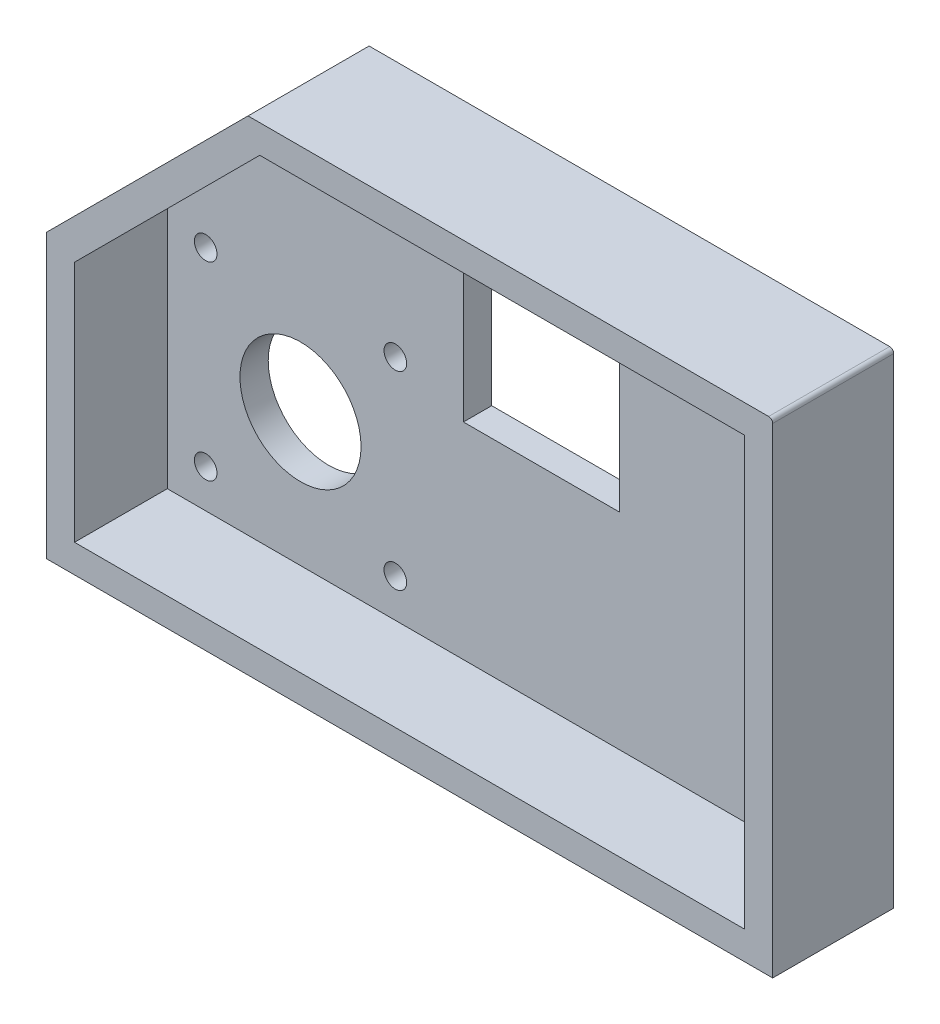
from build123d import *

# Parameters (mm, degrees)
BOSS_EXTRUDE1_DEPTH  = 30
SHELL1_T             = -7
SKETCH2_R            = 15
CUT_EXTRUDE1_DEPTH   = 20
SKETCH3_R            = 2.805999004
CUT_EXTRUDE2_DEPTH   = 20
LPATTERN1_COUNT      = 2
LPATTERN1_PITCH      = 47
LPATTERN1_COUNT_DIR2 = 2
LPATTERN1_PITCH_DIR2 = 47
SKETCH4_W            = 38.622861656
SKETCH4_H            = 38.365375911
CUT_EXTRUDE3_DEPTH   = 20


with BuildPart() as part:
    # Sketch1 → Boss-Extrude1 (new body)
    with BuildSketch(Plane.XY):
        with BuildLine():
            Line((-48.579903717, 70.777906396), (-98.579903717, 20.777906396))
            Line((-98.579903717, 20.777906396), (-98.579903717, -49.222093604))
            Line((-98.579903717, -49.222093604), (81.420096283, -49.222093604))
            Line((81.420096283, -49.222093604), (81.420096283, 69.777906396))
            ThreePointArc((81.420096283, 69.777906396), (81.127203064, 70.485013177), (80.420096283, 70.777906396))
            Line((80.420096283, 70.777906396), (-48.579903717, 70.777906396))
        make_face()
    extrude(amount=BOSS_EXTRUDE1_DEPTH)

    # Shell1
    shell1_openings = [part.faces().sort_by_distance(p)[0] for p in [
        (-4.076298463, 8.11549528, 30),
    ]]
    offset(amount=SHELL1_T, openings=shell1_openings, kind=Kind.INTERSECTION)

    # Sketch2 → Cut-Extrude1 (cut)
    with BuildSketch(Plane.XY.offset(7)):
        with Locations((-58.579903717, -9.222093604)):
            Circle(SKETCH2_R)
    extrude(amount=-CUT_EXTRUDE1_DEPTH, mode=Mode.SUBTRACT)

    # Sketch3 → Cut-Extrude2 (cut)
    with BuildSketch(Plane.XY.offset(7)):
        with Locations((-82.079903717, 14.277906396)):
            Circle(SKETCH3_R)
    cut_extrude2 = extrude(amount=-CUT_EXTRUDE2_DEPTH, mode=Mode.SUBTRACT)

    # LPattern1: Cut-Extrude2 2 × 2
    with Locations(*[(i * LPATTERN1_PITCH, -j * LPATTERN1_PITCH_DIR2, 0) for i in range(LPATTERN1_COUNT) for j in range(LPATTERN1_COUNT_DIR2) if (i, j) != (0, 0)]):
        add(cut_extrude2, mode=Mode.SUBTRACT)

    # Sketch4 → Cut-Extrude3 (cut)
    with BuildSketch(Plane.XY.offset(7)):
        with Locations((1.108051651, 27.962073286)):
            Rectangle(SKETCH4_W, SKETCH4_H)
    extrude(amount=-CUT_EXTRUDE3_DEPTH, mode=Mode.SUBTRACT)


solid = part.part
